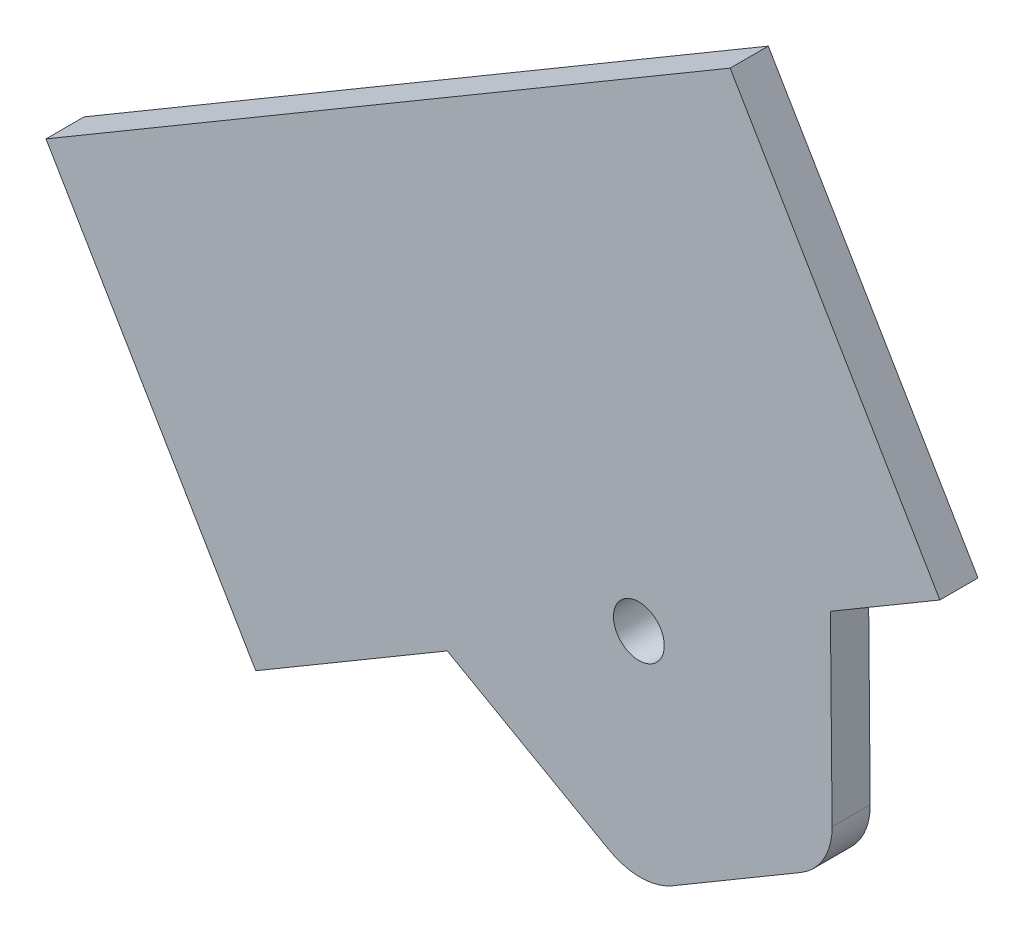
from build123d import *

# Parameters (mm, degrees)
SKETCH1_R           = 4
BOSS_EXTRUDE1_DEPTH = 6


with BuildPart() as part:
    # Sketch1 → Boss-Extrude1 (new body)
    with BuildSketch(Plane.XY):
        with BuildLine():
            Line((95.687041803, 386.103563742), (62.675802399, 442.096939002))
            Line((62.675802399, 442.096939002), (-45.003765409, 378.613786303))
            Line((-45.003765409, 378.613786303), (-11.992526005, 322.620411043))
            Line((-11.992526005, 322.620411043), (18.157752981, 340.395693799))
            Line((18.157752981, 340.395693799), (43.600659694, 326.013529743))
            ThreePointArc((43.600659694, 326.013529743), (48.612652005, 324.719368889), (53.600245097, 326.104588867))
            Line((53.600245097, 326.104588867), (73.80351169, 338.015549175))
            ThreePointArc((73.80351169, 338.015549175), (77.430284022, 341.708981412), (78.724444877, 346.720973723))
            Line((78.724444877, 346.720973723), (78.458310954, 375.94625931))
            Line((78.458310954, 375.94625931), (95.687041803, 386.103563742))
        make_face()
        with Locations((48.308031967, 358.170976554)):
            Circle(SKETCH1_R, mode=Mode.SUBTRACT)
    extrude(amount=BOSS_EXTRUDE1_DEPTH)


solid = part.part
